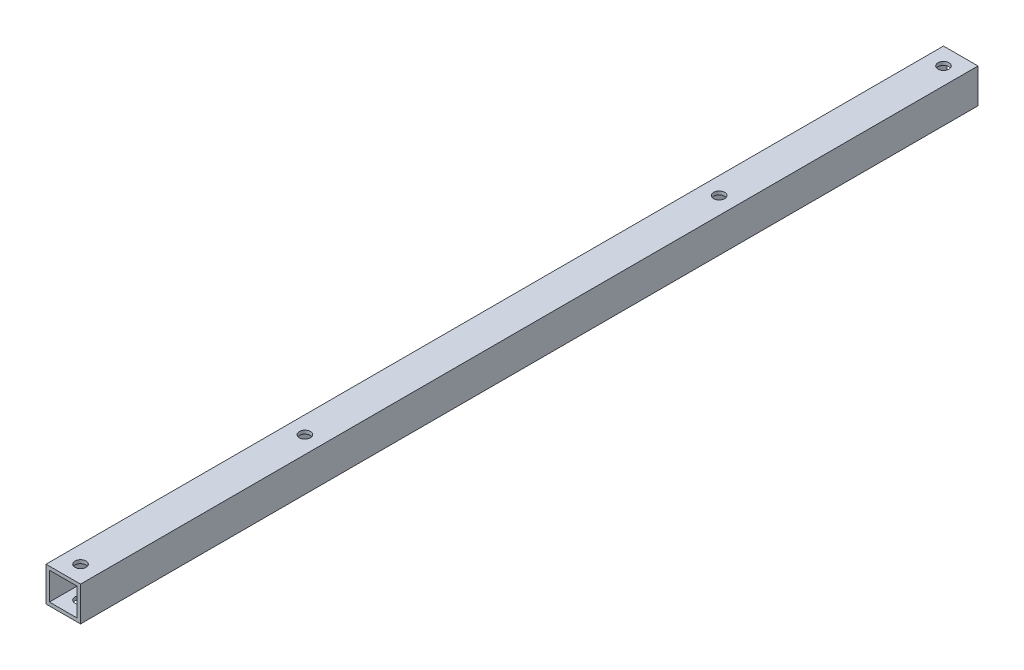
from build123d import *

# Parameters (mm, degrees)
SKETCH_281_W          = 10
SKETCH_281_H          = 10
SKETCH_281_W_2        = 8
SKETCH_281_H_2        = 8
EXTRUDE_338_DEPTH     = 260
SKETCH_410_R          = 1.6
CUT_EXTRUDE_779_DEPTH = 261.240273593


with BuildPart() as part:
    # Sketch 281 → Extrude 338 (new body)
    with BuildSketch(Plane.XY):
        Rectangle(SKETCH_281_W, SKETCH_281_H)
        Rectangle(SKETCH_281_W_2, SKETCH_281_H_2, mode=Mode.SUBTRACT)
    extrude(amount=EXTRUDE_338_DEPTH)

    # Sketch 410 → Cut-Extrude 779 (cut, through all)
    with BuildSketch(Plane(origin=(0, 5, 0), x_dir=(1, 0, 0), z_dir=(0, 1, 0))):
        with Locations(Location((0, -5, 0), (0, 0, 270))):
            Circle(SKETCH_410_R)
        with Locations(Location((0, -70, 0), (0, 0, 270))):
            Circle(SKETCH_410_R)
        with Locations(Location((0, -190, 0), (0, 0, 270))):
            Circle(SKETCH_410_R)
        with Locations(Location((0, -255, 0), (0, 0, 270))):
            Circle(SKETCH_410_R)
    extrude(amount=-CUT_EXTRUDE_779_DEPTH, mode=Mode.SUBTRACT)


solid = part.part
